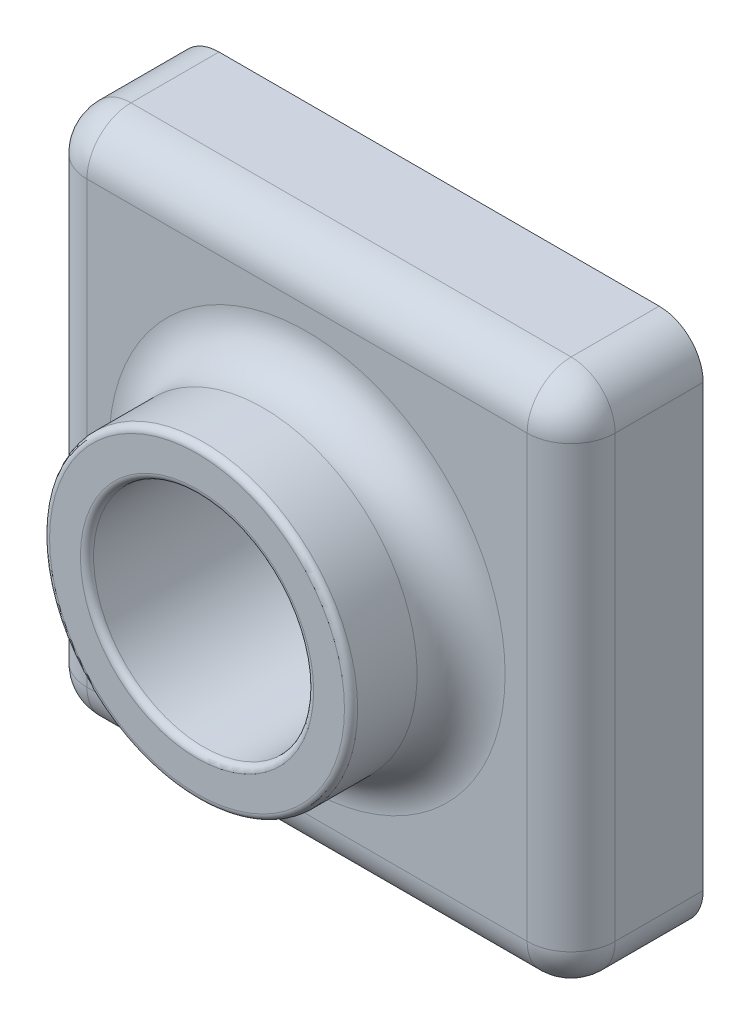
from build123d import *

# Parameters (mm, degrees)
SKETCH4_W           = 120
SKETCH4_H           = 120
BOSS_EXTRUDE1_DEPTH = 30
SKETCH6_R           = 35
BOSS_EXTRUDE2_DEPTH = 25
SKETCH8_R           = 25
CUT_EXTRUDE1_DEPTH  = 179.395627749
FILLET1_R           = 10
FILLET2_R           = 1.5
SHELL1_T            = -2


with BuildPart() as part:
    # Sketch4 → Boss-Extrude1 (new body)
    with BuildSketch(Plane.XY):
        with Locations((60, 60)):
            Rectangle(SKETCH4_W, SKETCH4_H)
    extrude(amount=BOSS_EXTRUDE1_DEPTH)

    # Sketch6 → Boss-Extrude2 (add)
    with BuildSketch(Plane.XY.offset(30)):
        with Locations((60, 60)):
            Circle(SKETCH6_R)
    extrude(amount=BOSS_EXTRUDE2_DEPTH)

    # Sketch8 → Cut-Extrude1 (cut, through all)
    with BuildSketch(Plane.XY.offset(55)):
        with Locations((60, 60)):
            Circle(SKETCH8_R)
    extrude(amount=-CUT_EXTRUDE1_DEPTH, mode=Mode.SUBTRACT)

    # Fillet1
    fillet1_edges = [part.edges().sort_by_distance(p)[0] for p in [
        (120, 60, 30),
        (25, 60, 30),
        (60, 120, 30),
        (0, 60, 30),
        (0, 120, 15),
        (120, 120, 15),
        (120, 0, 15),
        (0, 0, 15),
        (60, 0, 30),
    ]]
    fillet(fillet1_edges, radius=FILLET1_R)

    # Fillet2
    fillet2_edges = [part.edges().sort_by_distance(p)[0] for p in [
        (25, 60, 55),
        (35, 60, 55),
    ]]
    fillet(fillet2_edges, radius=FILLET2_R)

    # Shell1
    shell1_openings = [part.faces().sort_by_distance(p)[0] for p in [
        (60, 1.697056275, 0),
    ]]
    offset(amount=SHELL1_T, openings=shell1_openings, kind=Kind.INTERSECTION)


solid = part.part
